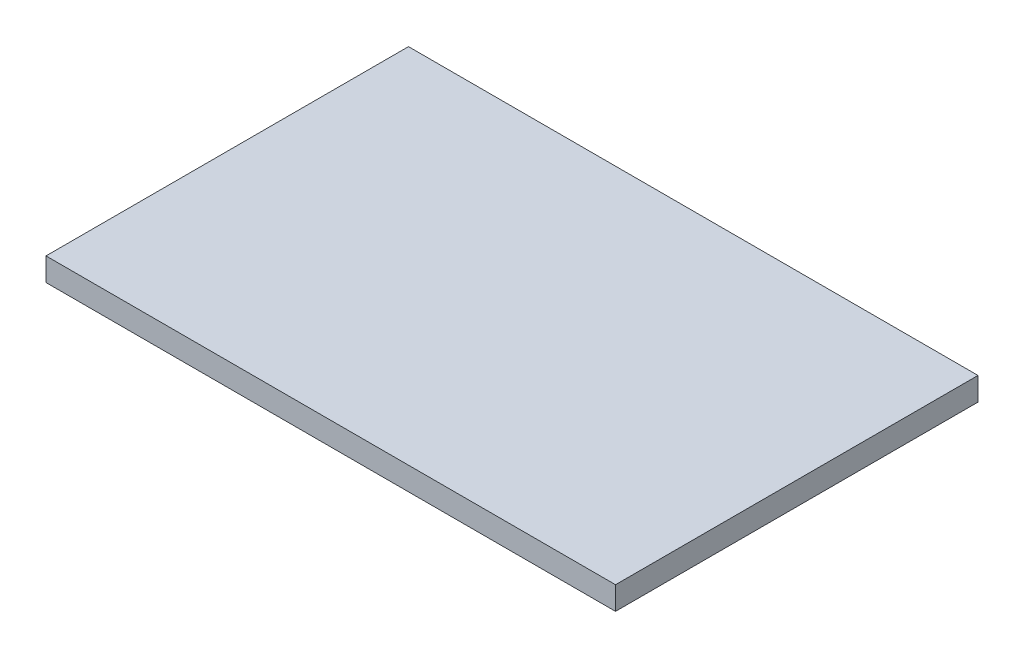
from build123d import *

# Parameters (mm, degrees)
CROQUIS1_W              = 1252.4
CROQUIS1_H              = 797.1
SALIENTE_EXTRUIR1_DEPTH = 50.8


with BuildPart() as part:
    # Croquis1 → Saliente-Extruir1 (new body)
    with BuildSketch(Plane(origin=(0, 0, 0), x_dir=(1, 0, 0), z_dir=(0, 1, 0))):
        with Locations((626.2, -398.55)):
            Rectangle(CROQUIS1_W, CROQUIS1_H)
    extrude(amount=SALIENTE_EXTRUIR1_DEPTH)


solid = part.part
